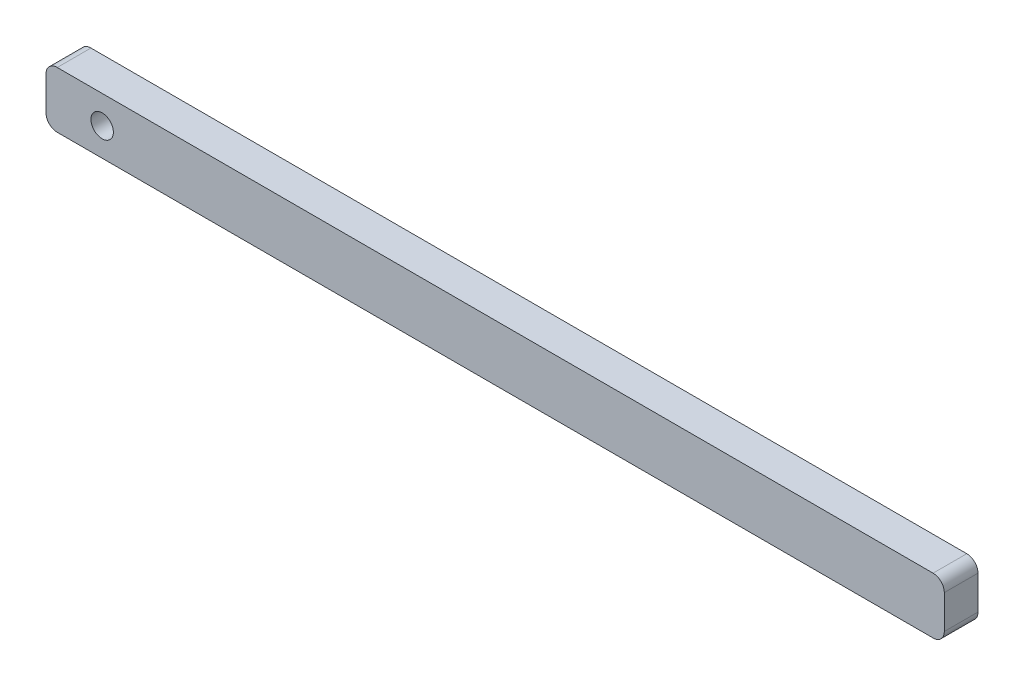
from build123d import *

# Parameters (mm, degrees)
SKETCH1_W           = 80
SKETCH1_H           = 5
BOSS_EXTRUDE1_DEPTH = 3
SKETCH2_R           = 1
CUT_EXTRUDE1_DEPTH  = 41.190172928
FILLET1_R           = 1


with BuildPart() as part:
    # Sketch1 → Boss-Extrude1 (new body)
    with BuildSketch(Plane.XY):
        Rectangle(SKETCH1_W, SKETCH1_H)
    extrude(amount=BOSS_EXTRUDE1_DEPTH)

    # Sketch2 → Cut-Extrude1 (cut, through all)
    with BuildSketch(Plane.XY.offset(3)):
        with Locations((-35, 0)):
            Circle(SKETCH2_R)
    extrude(amount=-CUT_EXTRUDE1_DEPTH, mode=Mode.SUBTRACT)

    # Fillet1
    fillet1_edges = [part.edges().sort_by_distance(p)[0] for p in [
        (-40, 2.5, 1.5),
        (40, 2.5, 1.5),
        (40, -2.5, 1.5),
        (-40, -2.5, 1.5),
    ]]
    fillet(fillet1_edges, radius=FILLET1_R)


solid = part.part
